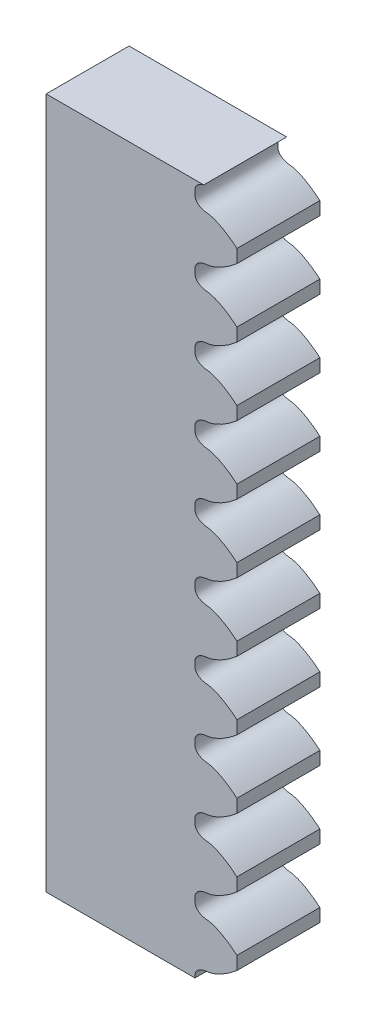
from build123d import *

# Parameters (mm, degrees)
SKETCH_1_W                      = 13.8
SKETCH_1_H                      = 6
EXTRUDE_1_DEPTH                 = 50
TOOTHEXTRUDECUTSPURPINION_START = -53.215323421
TOOTHEXTRUDECUTSPURPINION_DEPTH = 62.740323421
PATTERN_LINEAR_8_COUNT          = 13
PATTERN_LINEAR_8_PITCH          = 4.92


with BuildPart() as part:
    # Эскиз1 → Бобышка-Вытянуть1 (new body)
    with BuildSketch(Plane(origin=(0, 0, 0), x_dir=(1, 0, 0), z_dir=(0, 1, 0))):
        with Locations((6.9, -3)):
            Rectangle(SKETCH_1_W, SKETCH_1_H)
    extrude(amount=EXTRUDE_1_DEPTH)

    # SketchToothSpurPinion → ToothExtrudeCutSpurPinion (cut)
    with BuildSketch(Plane.XY.offset(6).offset(TOOTHEXTRUDECUTSPURPINION_START)):
        with BuildLine():
            ThreePointArc((13.81461503, 1.997869118), (13.958333333, 0), (13.81461503, -1.997869118))
            add(Edge.make_bspline(
                [(13.81461503, -1.997869118), (13.698793969, -1.897449281), (13.525164787, -1.75589753), (13.291217146, -1.583686739), (13.126664421, -1.470510764), (12.96875534, -1.369204581), (12.81807175, -1.279218647), (12.675166862, -1.199978378), (12.540564252, -1.130885755), (12.414756935, -1.071320562), (12.298206492, -1.020641773), (12.191342258, -0.978188864), (12.094560541, -0.943283458), (12.008223976, -0.915230072), (11.932660705, -0.893319744), (11.868164321, -0.876825114), (11.814991796, -0.865020609), (11.773367259, -0.857132926), (11.743470731, -0.852473468), (11.725461955, -0.850148873), (11.690012991, -0.846916443), (11.647489464, -0.843589638), (11.594367814, -0.837043671), (11.556066215, -0.831645799), (11.518479821, -0.825530404), (11.481594494, -0.818726254), (11.445398127, -0.811217755), (11.409876051, -0.802996839), (11.375012208, -0.794048687), (11.340788852, -0.784354661), (11.307186718, -0.773890594), (11.274185169, -0.762626136), (11.241762499, -0.750523651), (11.209896404, -0.737537036), (11.1785647, -0.723610365), (11.147746379, -0.708676379), (11.117423111, -0.692654849), (11.087581348, -0.675450874), (11.0582152, -0.656953229), (11.029330316, -0.637032964), (11.000948966, -0.615542577), (10.973116556, -0.592316237), (10.94590969, -0.567171764), (10.919445694, -0.539915289), (10.893893157, -0.51034976), (10.869482403, -0.478288531), (10.846514049, -0.443575078), (10.825362479, -0.406109181), (10.806471485, -0.365878146), (10.790334245, -0.322990275), (10.777470535, -0.277701322), (10.768341668, -0.230436968), (10.763825199, -0.185573942), (10.761877337, -0.108617629), (10.76548092, 0), (10.761877337, 0.108617629), (10.763825199, 0.185573942), (10.768341668, 0.230436968), (10.777470535, 0.277701322), (10.790334245, 0.322990275), (10.806471485, 0.365878146), (10.825362479, 0.406109181), (10.846514049, 0.443575078), (10.869482403, 0.478288531), (10.893893157, 0.51034976), (10.919445694, 0.539915289), (10.94590969, 0.567171764), (10.973116556, 0.592316237), (11.000948966, 0.615542577), (11.029330316, 0.637032964), (11.0582152, 0.656953229), (11.087581348, 0.675450874), (11.117423111, 0.692654849), (11.147746379, 0.708676379), (11.1785647, 0.723610365), (11.209896404, 0.737537036), (11.241762499, 0.750523651), (11.274185169, 0.762626136), (11.307186718, 0.773890594), (11.340788852, 0.784354661), (11.375012208, 0.794048687), (11.409876051, 0.802996839), (11.445398127, 0.811217755), (11.481594494, 0.818726254), (11.518479821, 0.825530404), (11.556066215, 0.831645799), (11.594367814, 0.837043671), (11.647489464, 0.843589638), (11.690012991, 0.846916443), (11.725461955, 0.850148873), (11.743470731, 0.852473468), (11.773367259, 0.857132926), (11.814991796, 0.865020609), (11.868164321, 0.876825114), (11.932660705, 0.893319744), (12.008223976, 0.915230072), (12.094560541, 0.943283458), (12.191342258, 0.978188864), (12.298206492, 1.020641773), (12.414756935, 1.071320562), (12.540564252, 1.130885755), (12.675166862, 1.199978378), (12.81807175, 1.279218647), (12.96875534, 1.369204581), (13.126664421, 1.470510764), (13.291217146, 1.583686739), (13.525164787, 1.75589753), (13.698793969, 1.897449281), (13.81461503, 1.997869118)],
                knots=[0, 0, 0, 0, 0.059354085, 0.086688204, 0.112460372, 0.136670591, 0.159318861, 0.180405181, 0.199929551, 0.217891972, 0.234292443, 0.249130965, 0.262407537, 0.27412216, 0.284274833, 0.292865557, 0.299894332, 0.305361157, 0.309266033, 0.311608961, 0.312389947, 0.323048368, 0.328120377, 0.333111369, 0.338024664, 0.342863925, 0.347633206, 0.352337001, 0.356980291, 0.361568614, 0.366108128, 0.370605687, 0.375068927, 0.379506353, 0.383927434, 0.388342706, 0.392763858, 0.397203826, 0.401676849, 0.406198494, 0.410785613, 0.415456199, 0.420229099, 0.425123526, 0.43015831, 0.435350837, 0.440715626, 0.446262589, 0.451995067, 0.457907883, 0.463985799, 0.47020283, 0.476522841, 0.481419136, 0.5, 0.518580864, 0.523477159, 0.52979717, 0.536014201, 0.542092117, 0.548004933, 0.553737411, 0.559284374, 0.564649163, 0.56984169, 0.574876474, 0.579770901, 0.584543801, 0.589214387, 0.593801506, 0.598323151, 0.602796174, 0.607236142, 0.611657294, 0.616072566, 0.620493647, 0.624931073, 0.629394313, 0.633891872, 0.638431386, 0.643019709, 0.647662999, 0.652366794, 0.657136075, 0.661975336, 0.666888631, 0.671879623, 0.676951632, 0.687610053, 0.688391039, 0.690733967, 0.694638843, 0.700105668, 0.707134443, 0.715725167, 0.72587784, 0.737592463, 0.750869035, 0.765707557, 0.782108028, 0.800070449, 0.819594819, 0.840681139, 0.863329409, 0.887539628, 0.913311796, 0.940645915, 1, 1, 1, 1], degree=3))
        make_face()
    toothextrudecutspurpinion = extrude(amount=TOOTHEXTRUDECUTSPURPINION_DEPTH, mode=Mode.SUBTRACT)

    # Линейный массив8: ToothExtrudeCutSpurPinion ×13
    with Locations(*[(0, i * PATTERN_LINEAR_8_PITCH, 0) for i in range(1, PATTERN_LINEAR_8_COUNT)]):
        add(toothextrudecutspurpinion, mode=Mode.SUBTRACT)


solid = part.part
